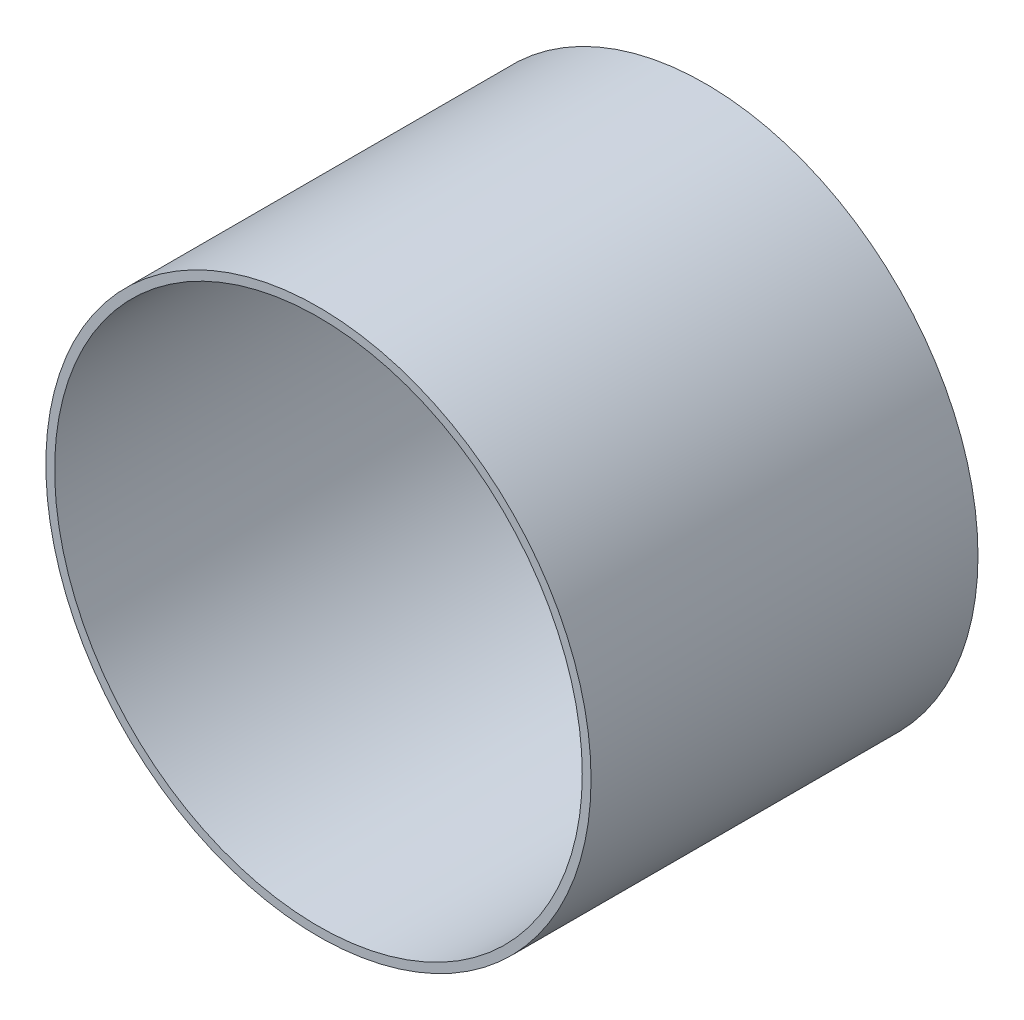
from build123d import *

# Parameters (mm, degrees)
CROQUIS1_R              = 15.5
CROQUIS1_R_2            = 15
SALIENTE_EXTRUIR1_DEPTH = 22


with BuildPart() as part:
    # Croquis1 → Saliente-Extruir1 (new body)
    with BuildSketch(Plane.XY):
        Circle(CROQUIS1_R)
        Circle(CROQUIS1_R_2, mode=Mode.SUBTRACT)
    extrude(amount=SALIENTE_EXTRUIR1_DEPTH)


solid = part.part
